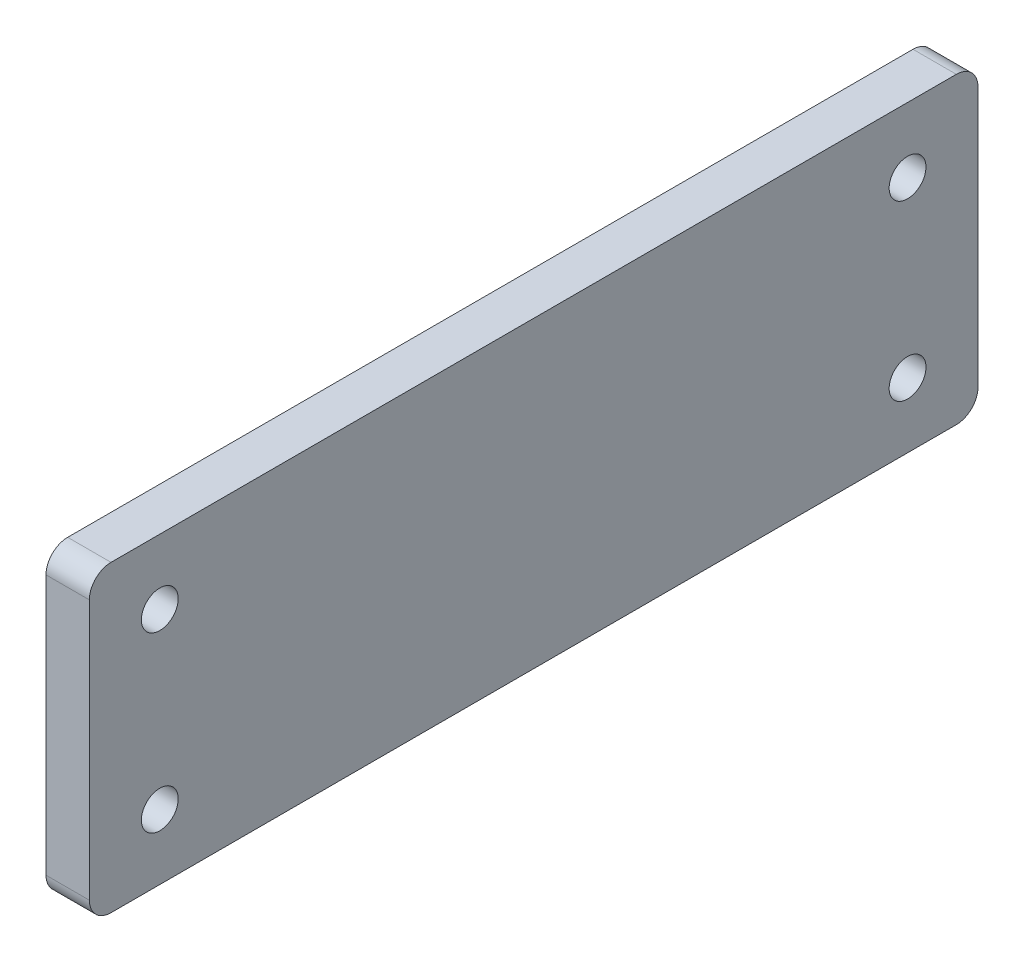
from build123d import *

# Parameters (mm, degrees)
SKETCH_1_R      = 0.85
EXTRUDE_1_DEPTH = 2


with BuildPart() as part:
    # 草图1 → 凸台-拉伸1 (new body)
    with BuildSketch(Plane(origin=(0, 0, 0), x_dir=(0, 0, -1), z_dir=(1, 0, 0))):
        with BuildLine():
            Line((-19.5, 7), (19.5, 7))
            ThreePointArc((19.5, 7), (20.207106781, 6.707106781), (20.5, 6))
            Line((20.5, 6), (20.5, -6))
            ThreePointArc((20.5, -6), (20.207106781, -6.707106781), (19.5, -7))
            Line((19.5, -7), (-19.5, -7))
            ThreePointArc((-19.5, -7), (-20.207106781, -6.707106781), (-20.5, -6))
            Line((-20.5, -6), (-20.5, 6))
            ThreePointArc((-20.5, 6), (-20.207106781, 6.707106781), (-19.5, 7))
        make_face()
        with Locations((-17.25, 4)):
            Circle(SKETCH_1_R, mode=Mode.SUBTRACT)
        with Locations((-17.25, -4)):
            Circle(SKETCH_1_R, mode=Mode.SUBTRACT)
        with Locations((17.25, -4)):
            Circle(SKETCH_1_R, mode=Mode.SUBTRACT)
        with Locations((17.25, 4)):
            Circle(SKETCH_1_R, mode=Mode.SUBTRACT)
    extrude(amount=EXTRUDE_1_DEPTH)


solid = part.part
